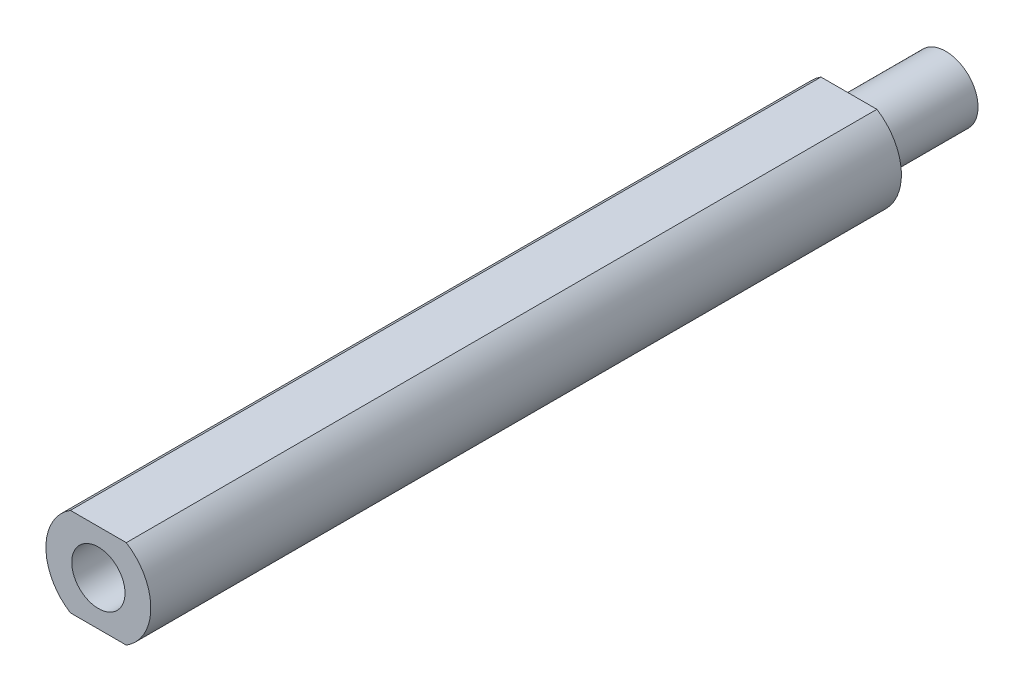
from build123d import *

# Parameters (mm, degrees)
EXTRUDE_1_DEPTH        = 46.5
HOLE_WIZARD_M4_1_D     = 3.3
HOLE_WIZARD_M4_1_DEPTH = 12
HOLE_WIZARD_M4_1_TIP   = 0.991420021
SKETCH_4_R             = 2
EXTRUDE_2_DEPTH        = 6


with BuildPart() as part:
    # 草图1 → 凸台-拉伸1 (new body)
    with BuildSketch(Plane.XY):
        with BuildLine():
            Line((-1.732050808, 2.75), (1.732050808, 2.75))
            ThreePointArc((1.732050808, 2.75), (3.25, 0), (1.732050808, -2.75))
            Line((1.732050808, -2.75), (-1.732050808, -2.75))
            ThreePointArc((-1.732050808, -2.75), (-3.25, 0), (-1.732050808, 2.75))
        make_face()
    extrude(amount=EXTRUDE_1_DEPTH)

    # M4 螺纹孔1
    with Locations(Plane.XY.offset(46.5)):
        with Locations((0, 0)):
            Hole(HOLE_WIZARD_M4_1_D / 2, depth=HOLE_WIZARD_M4_1_DEPTH)
            with Locations((0, 0, -(HOLE_WIZARD_M4_1_DEPTH + HOLE_WIZARD_M4_1_TIP / 2))):  # 118° drill point
                Cone(0, HOLE_WIZARD_M4_1_D / 2, HOLE_WIZARD_M4_1_TIP, mode=Mode.SUBTRACT)

    # 草图4 → 凸台-拉伸2 (add)
    with BuildSketch(Plane(origin=(0, 0, 0), x_dir=(-1, 0, 0), z_dir=(0, 0, -1))):
        Circle(SKETCH_4_R)
    extrude(amount=EXTRUDE_2_DEPTH)


solid = part.part
